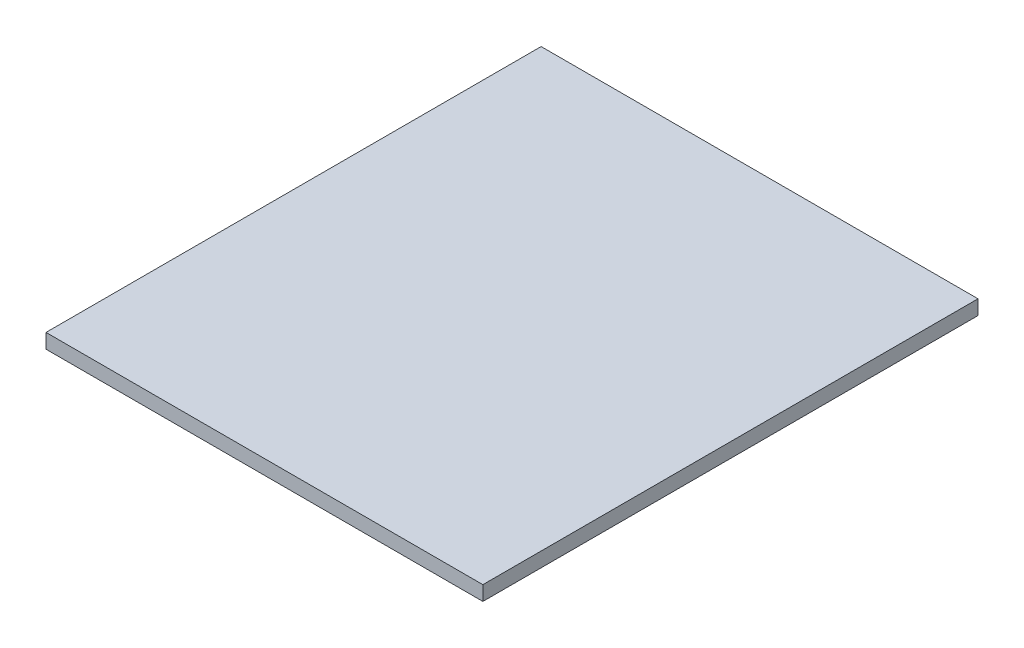
from build123d import *

# Parameters (mm, degrees)
SKETCH1_W           = 150
SKETCH1_H           = 170
BOSS_EXTRUDE1_DEPTH = 5


with BuildPart() as part:
    # Sketch1 → Boss-Extrude1 (new body)
    with BuildSketch(Plane(origin=(0, 0, 0), x_dir=(1, 0, 0), z_dir=(0, 1, 0))):
        with Locations((-2.392120075, 45.037523452)):
            Rectangle(SKETCH1_W, SKETCH1_H)
    extrude(amount=BOSS_EXTRUDE1_DEPTH)


solid = part.part
